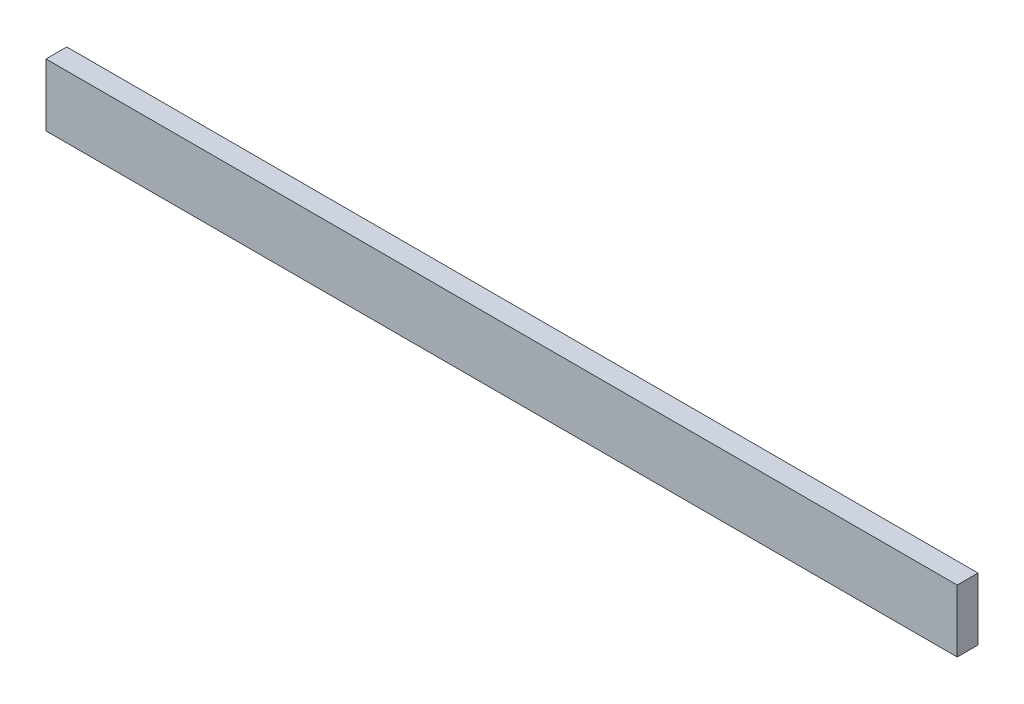
from build123d import *

# Parameters (mm, degrees)
SKETCH1_W           = 278.384
SKETCH1_H           = 19.05
BOSS_EXTRUDE1_DEPTH = 6.35


with BuildPart() as part:
    # Sketch1 → Boss-Extrude1 (new body)
    with BuildSketch(Plane.XY):
        with Locations((139.192, 9.525)):
            Rectangle(SKETCH1_W, SKETCH1_H)
    extrude(amount=BOSS_EXTRUDE1_DEPTH)


solid = part.part
